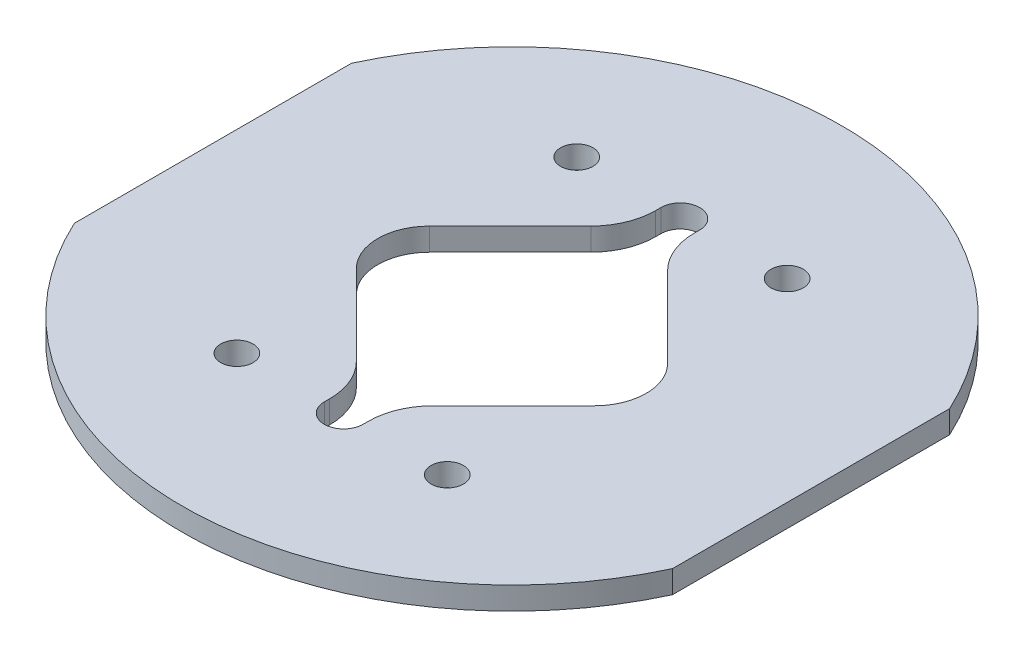
from build123d import *

# Parameters (mm, degrees)
BOSS_EXTRUDE1_DEPTH = 1.75
CUT_EXTRUDE1_DEPTH  = 35.422145488
CUT_EXTRUDE2_DEPTH  = 1.75
FILLET2_R           = 5
FILLET1_R           = 4
SKETCH6_R           = 1.25
CUT_EXTRUDE3_DEPTH  = 35.422145488
CIRPATTERN3_COUNT   = 2


with BuildPart() as part:
    # Sketch1 → Boss-Extrude1 (new body)
    with BuildSketch(Plane(origin=(0, 0, 0), x_dir=(1, 0, 0), z_dir=(0, 1, 0))):
        with BuildLine():
            Line((-23.1, -10.705213683), (-23.1, 10.705213683))
            ThreePointArc((-23.1, 10.705213683), (0, 25.46), (23.1, 10.705213683))
            Line((23.1, 10.705213683), (23.1, -10.705213683))
            ThreePointArc((23.1, -10.705213683), (0, -25.46), (-23.1, -10.705213683))
        make_face()
    extrude(amount=BOSS_EXTRUDE1_DEPTH)

    # Sketch3 → Cut-Extrude1 (cut, through all)
    with BuildSketch(Plane(origin=(0, 1.75, 0), x_dir=(1, 0, 0), z_dir=(0, 1, 0))):
        Polygon((0, -12.02081528), (-12.02081528, 0), (0, 12.02081528), (12.02081528, 0), align=None)
    extrude(amount=-CUT_EXTRUDE1_DEPTH, mode=Mode.SUBTRACT)

    # Sketch4 → Cut-Extrude2 (cut)
    with BuildSketch(Plane(origin=(0, 1.75, 0), x_dir=(1, 0, 0), z_dir=(0, 1, 0))):
        with BuildLine():
            Line((-1.5, 13), (-1.5, -13))
            ThreePointArc((-1.5, -13), (0, -14.5), (1.5, -13))
            Line((1.5, -13), (1.5, 13))
            ThreePointArc((1.5, 13), (0, 14.5), (-1.5, 13))
        make_face()
    extrude(amount=-CUT_EXTRUDE2_DEPTH, mode=Mode.SUBTRACT)

    # Fillet2
    fillet2_edges = [part.edges().sort_by_distance(p)[0] for p in [
        (1.5, 0.875, -10.52081528),
        (-1.5, 0.875, -10.52081528),
        (-1.5, 0.875, 10.52081528),
        (1.5, 0.875, 10.52081528),
    ]]
    fillet(fillet2_edges, radius=FILLET2_R)

    # Fillet1
    fillet1_edges = [part.edges().sort_by_distance(p)[0] for p in [
        (12.02081528, 0.875, 0),
        (-12.02081528, 0.875, 0),
    ]]
    fillet(fillet1_edges, radius=FILLET1_R)

    # Sketch6 → Cut-Extrude3 (cut, through all)
    with BuildSketch(Plane(origin=(0, 1.75, 0), x_dir=(1, 0, 0), z_dir=(0, 1, 0))):
        with Locations(Location((-8.125, 13.125, 0), (0, 0, 270))):
            Circle(SKETCH6_R)
        with Locations(Location((8.125, 13.125, 0), (0, 0, 270))):
            Circle(SKETCH6_R)
    cut_extrude3 = extrude(amount=-CUT_EXTRUDE3_DEPTH, mode=Mode.SUBTRACT)

    # CirPattern3: Cut-Extrude3 ×2 about axis
    cirpattern3_axis = Axis((0, 0, 0), (0, 1, 0))
    for i in range(1, CIRPATTERN3_COUNT):
        add(cut_extrude3.rotate(cirpattern3_axis, i * 360 / CIRPATTERN3_COUNT), mode=Mode.SUBTRACT)


solid = part.part
